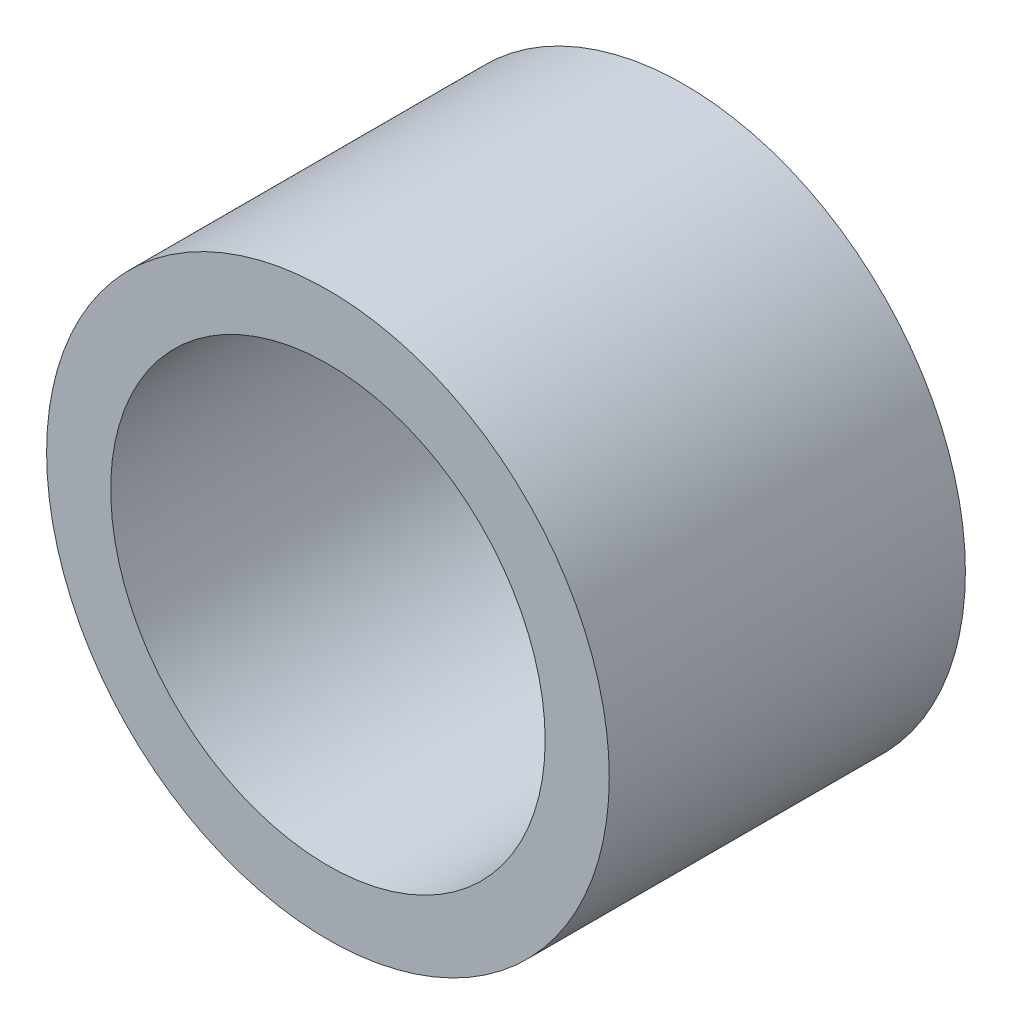
from build123d import *

# Parameters (mm, degrees)
EXTRUDE_1_DEPTH      = 2.5
EXTRUDE_1_DEPTH_BACK = 2.5
SKETCH_1_R           = 3.95
SKETCH_1_R_2         = 3.05


with BuildPart() as part:
    # 草图1 → 凸台-拉伸1 (new, two sides: drawn at the far end of the back side and taken through both)
    with BuildSketch(Plane.XY.offset(-EXTRUDE_1_DEPTH_BACK)):
        Circle(SKETCH_1_R)
        Circle(SKETCH_1_R_2, mode=Mode.SUBTRACT)
    extrude(amount=EXTRUDE_1_DEPTH + EXTRUDE_1_DEPTH_BACK)


solid = part.part
